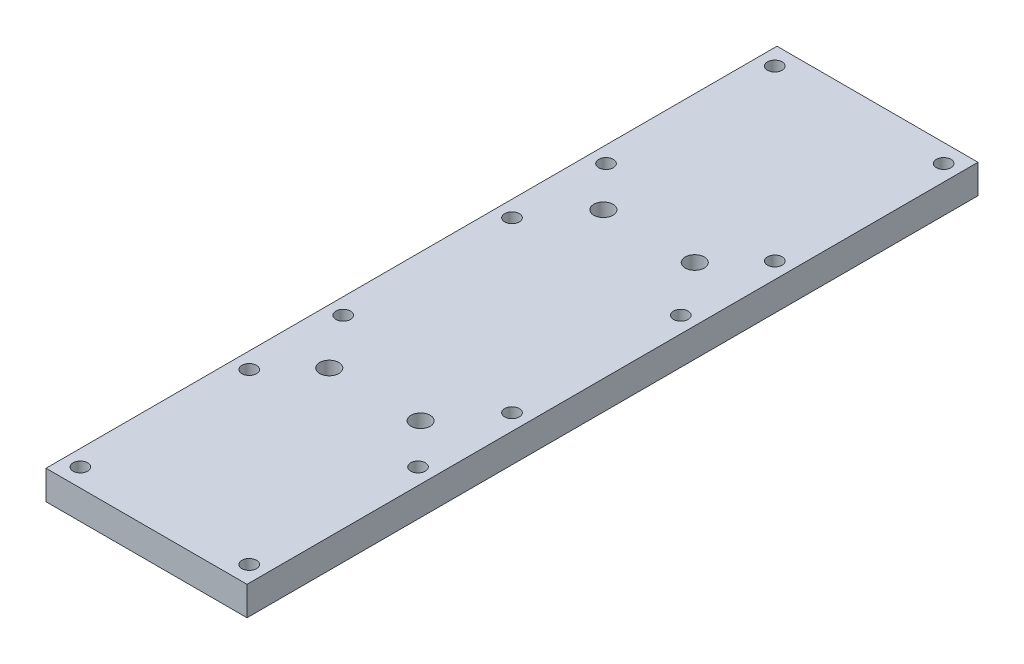
from build123d import *

# Parameters (mm, degrees)
SKETCH1_W           = 44
SKETCH1_H           = 160
BOSS_EXTRUDE1_DEPTH = 6.35
SKETCH2_R           = 1.6
CUT_EXTRUDE1_DEPTH  = 84.212514083
SKETCH3_R           = 2.1
CUT_EXTRUDE2_DEPTH  = 84.212514083


with BuildPart() as part:
    # Sketch1 → Boss-Extrude1 (new body)
    with BuildSketch(Plane(origin=(0, 0, 0), x_dir=(1, 0, 0), z_dir=(0, 1, 0))):
        Rectangle(SKETCH1_W, SKETCH1_H)
    extrude(amount=BOSS_EXTRUDE1_DEPTH)

    # Sketch2 → Cut-Extrude1 (cut, through all)
    with BuildSketch(Plane(origin=(0, 6.35, 0), x_dir=(1, 0, 0), z_dir=(0, 1, 0))):
        with Locations(Location((-18.475, 18.475, 0), (0, 0, 270))):
            Circle(SKETCH2_R)
        with Locations(Location((-18.475, -18.475, 0), (0, 0, 270))):
            Circle(SKETCH2_R)
        with Locations(Location((18.475, -18.475, 0), (0, 0, 270))):
            Circle(SKETCH2_R)
        with Locations(Location((18.475, 18.475, 0), (0, 0, 270))):
            Circle(SKETCH2_R)
        with Locations(Location((-18.475, 76, 0), (0, 0, 270))):
            Circle(SKETCH2_R)
        with Locations(Location((-18.475, 39.05, 0), (0, 0, 270))):
            Circle(SKETCH2_R)
        with Locations(Location((18.475, 39.05, 0), (0, 0, 270))):
            Circle(SKETCH2_R)
        with Locations(Location((18.475, 76, 0), (0, 0, 270))):
            Circle(SKETCH2_R)
        with Locations(Location((-18.475, -39.05, 0), (0, 0, 270))):
            Circle(SKETCH2_R)
        with Locations(Location((-18.475, -76, 0), (0, 0, 270))):
            Circle(SKETCH2_R)
        with Locations(Location((18.475, -76, 0), (0, 0, 270))):
            Circle(SKETCH2_R)
        with Locations(Location((18.475, -39.05, 0), (0, 0, 270))):
            Circle(SKETCH2_R)
    extrude(amount=-CUT_EXTRUDE1_DEPTH, mode=Mode.SUBTRACT)

    # Sketch3 → Cut-Extrude2 (cut, through all)
    with BuildSketch(Plane(origin=(0, 6.35, 0), x_dir=(1, 0, 0), z_dir=(0, 1, 0))):
        with Locations(Location((-10, 30, 0), (0, 0, 270))):
            Circle(SKETCH3_R)
        with Locations(Location((10, 30, 0), (0, 0, 270))):
            Circle(SKETCH3_R)
        with Locations(Location((-10, -30, 0), (0, 0, 270))):
            Circle(SKETCH3_R)
        with Locations(Location((10, -30, 0), (0, 0, 270))):
            Circle(SKETCH3_R)
    extrude(amount=-CUT_EXTRUDE2_DEPTH, mode=Mode.SUBTRACT)


solid = part.part
